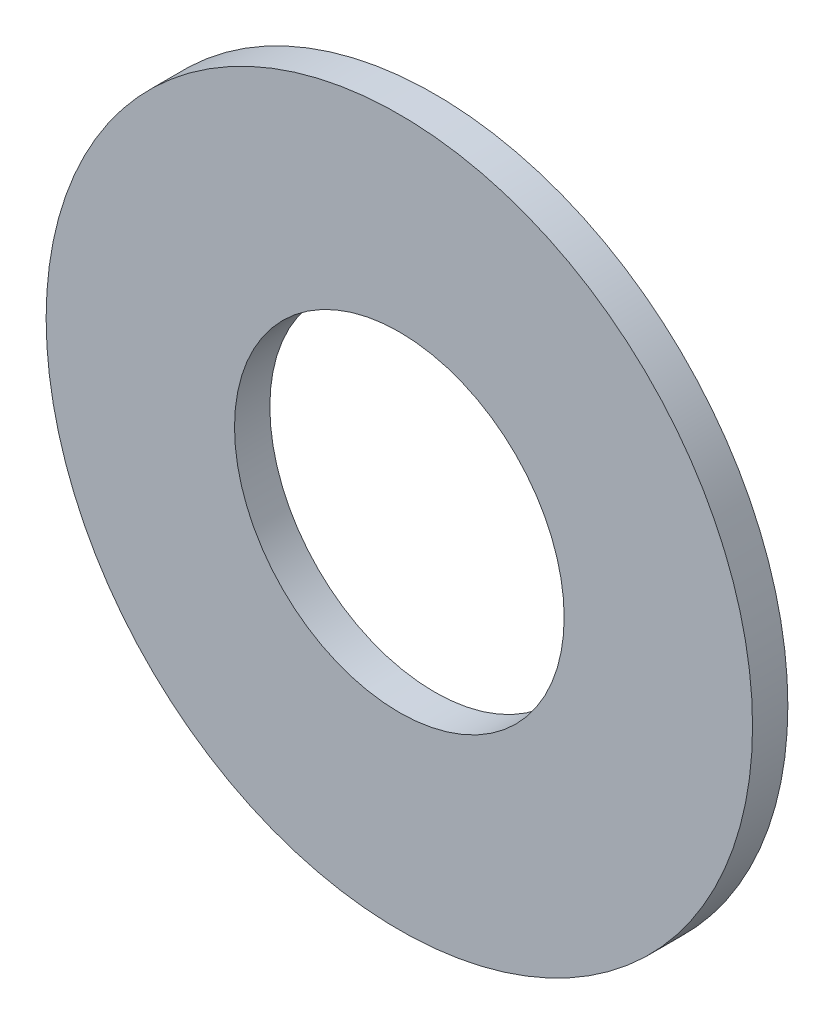
from build123d import *

# Parameters (mm, degrees)
SKETCH_1_W = 16
SKETCH_1_H = 3


with BuildPart() as part:
    # Эскиз1 → Повернуть1 (revolve)
    with BuildSketch(Plane(origin=(0, 0, 0), x_dir=(1, 0, 0), z_dir=(0, 1, 0))):
        with Locations((22, 0)):
            Rectangle(SKETCH_1_W, SKETCH_1_H)
    revolve(axis=Axis((0, 0, -1.5), (0, 0, 1)))


solid = part.part
